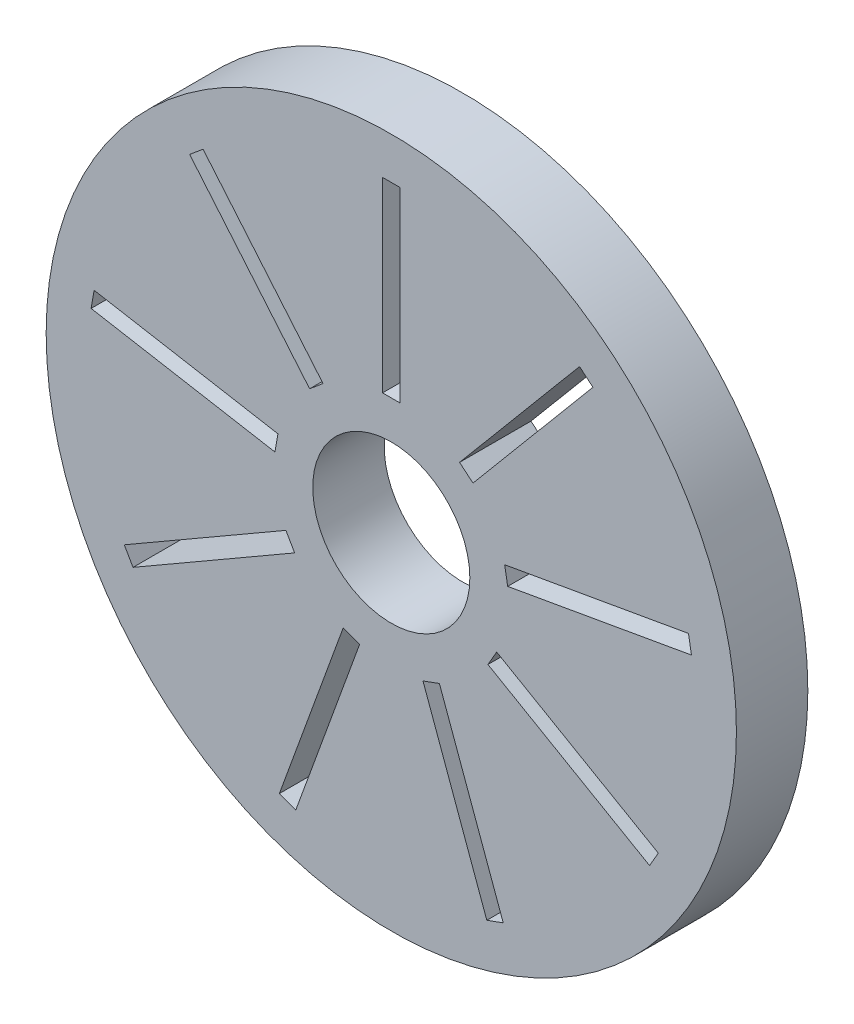
from build123d import *

# Parameters (mm, degrees)
SKETCH_1_R          = 29
EXTRUDE_1_DEPTH     = 6
SKETCH_2_R          = 6.6
CUT_EXTRUDE_1_DEPTH = 42.448763552
SKETCH_3_W          = 1.470113788
SKETCH_3_H          = 15.681213729
CUT_EXTRUDE_2_DEPTH = 42.448763552


with BuildPart() as part:
    # 草图1 → 凸台-拉伸1 (new body)
    with BuildSketch(Plane.XY):
        Circle(SKETCH_1_R)
    extrude(amount=EXTRUDE_1_DEPTH)

    # 草图2 → 切除-拉伸1 (cut, through all)
    with BuildSketch(Plane.XY.offset(6)):
        Circle(SKETCH_2_R)
    extrude(amount=-CUT_EXTRUDE_1_DEPTH, mode=Mode.SUBTRACT)

    # 草图3 → 切除-拉伸2 (cut, through all)
    with BuildSketch(Plane.XY.offset(6)):
        Polygon((15.816409823, 19.992808752), (5.736719933, 7.980302113), (6.86289243, 7.035331186), (16.94258232, 19.047837825), align=None)
        with Locations((0, 17.641365445)):
            Rectangle(SKETCH_3_W, SKETCH_3_H)
        Polygon((24.967202603, 5.148787783), (9.524221746, 2.425773595), (9.779504326, 0.97799414), (25.222485183, 3.701008327), align=None)
        Polygon((22.435563806, -12.104408212), (8.855234354, -4.263801347), (8.120177461, -5.536957234), (21.700506913, -13.377564098), align=None)
        Polygon((9.406075361, -23.693817079), (4.042784393, -8.958296253), (2.661329316, -9.461104781), (8.024620283, -24.196625607), align=None)
        Polygon((-8.024620283, -24.196625607), (-2.661329316, -9.461104781), (-4.042784393, -8.958296253), (-9.406075361, -23.693817079), align=None)
        Polygon((-21.700506913, -13.377564098), (-8.120177461, -5.536957234), (-8.855234354, -4.263801347), (-22.435563806, -12.104408212), align=None)
        Polygon((-25.222485183, 3.701008327), (-9.779504326, 0.97799414), (-9.524221746, 2.425773595), (-24.967202603, 5.148787783), align=None)
        Polygon((-16.94258232, 19.047837825), (-6.86289243, 7.035331186), (-5.736719933, 7.980302113), (-15.816409823, 19.992808752), align=None)
    extrude(amount=-CUT_EXTRUDE_2_DEPTH, mode=Mode.SUBTRACT)


solid = part.part
